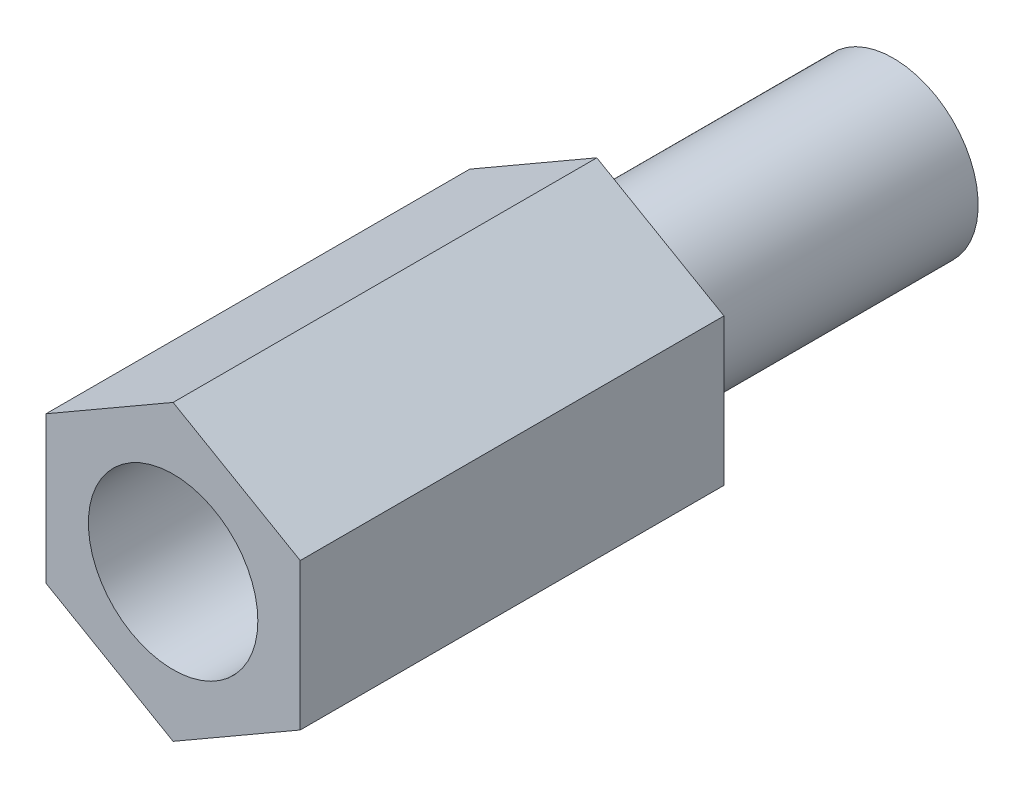
from build123d import *

# Parameters (mm, degrees)
EXTRUDE_1_DEPTH     = 10
SKETCH_2_R          = 2
CUT_EXTRUDE_1_DEPTH = 4
SKETCH_3_R          = 2
EXTRUDE_2_DEPTH     = 7


with BuildPart() as part:
    # 草图1 → 凸台-拉伸1 (new body)
    with BuildSketch(Plane.XY):
        Polygon((0, -3.464101615), (3, -1.732050808), (3, 1.732050808), (0, 3.464101615), (-3, 1.732050808), (-3, -1.732050808), align=None)
    extrude(amount=EXTRUDE_1_DEPTH)

    # 草图2 → 切除-拉伸1 (cut)
    with BuildSketch(Plane.XY.offset(10)):
        Circle(SKETCH_2_R)
    extrude(amount=-CUT_EXTRUDE_1_DEPTH, mode=Mode.SUBTRACT)

    # 草图3 → 凸台-拉伸2 (add)
    with BuildSketch(Plane(origin=(0, 0, 0), x_dir=(-1, 0, 0), z_dir=(0, 0, -1))):
        with Locations(Location((0, 0, 0), (0, 0, 180))):
            Circle(SKETCH_3_R)
    extrude(amount=EXTRUDE_2_DEPTH)


solid = part.part
